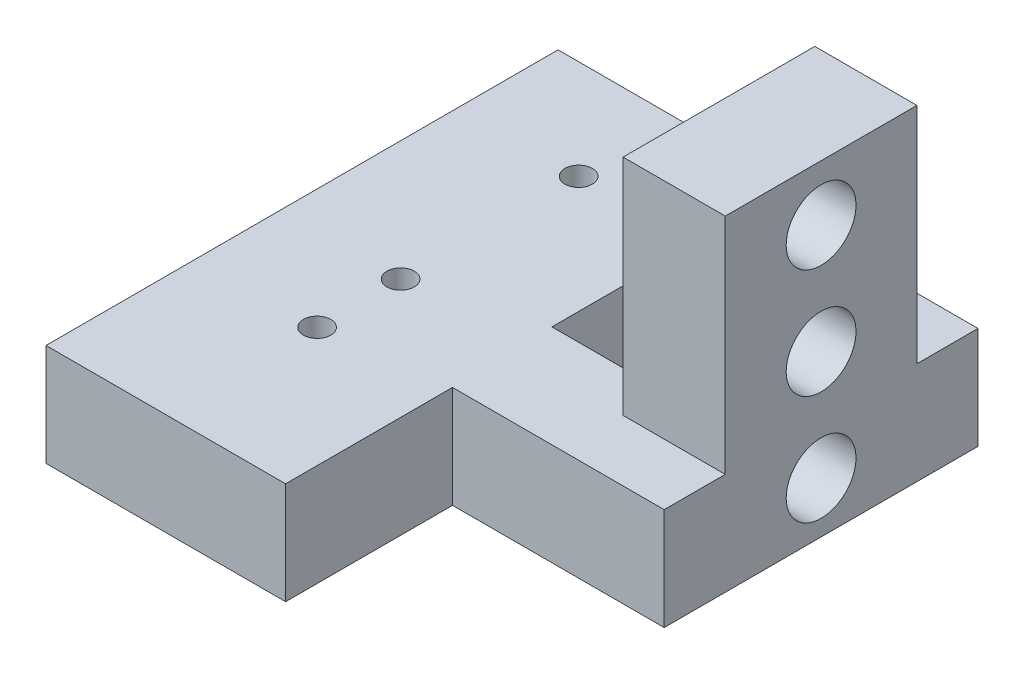
from build123d import *

# Parameters (mm, degrees)
SKETCH1_W           = 8.2
SKETCH1_H           = 8
BOSS_EXTRUDE1_DEPTH = 7.46
BOSS_EXTRUDE2_DEPTH = 16.34
SKETCH4_R           = 2.55
CUT_EXTRUDE1_DEPTH  = 43.142763317
CUT_EXTRUDE2_DEPTH  = 1.1
CUT_EXTRUDE4_REACH  = 42.752
SKETCH6_R           = 1


with BuildPart() as part:
    # Sketch1 → Boss-Extrude1 (new body)
    with BuildSketch(Plane(origin=(0, 0, 0), x_dir=(1, 0, 0), z_dir=(0, 1, 0))):
        Polygon((8.75, 11.46), (24.21, 11.46), (24.21, -11.46), (8.75, -11.46), (8.75, -23.65), (-8.75, -23.65), (-8.75, 13.75), (8.75, 13.75), align=None)
        with Locations((12.65, 0)):
            Rectangle(SKETCH1_W, SKETCH1_H, mode=Mode.SUBTRACT)
    extrude(amount=BOSS_EXTRUDE1_DEPTH)

    # Sketch3 → Boss-Extrude2 (add)
    with BuildSketch(Plane(origin=(0, 7.46, 0), x_dir=(1, 0, 0), z_dir=(0, 1, 0))):
        Polygon((16.75, 7), (24.21, 7), (24.21, -7), (16.75, -7), (16.75, -4), (16.75, 4), align=None)
    extrude(amount=BOSS_EXTRUDE2_DEPTH)

    # Sketch4 → Cut-Extrude1 (cut, through all)
    with BuildSketch(Plane.ZY.offset(-16.75)):
        with Locations((0, 3.73)):
            Circle(SKETCH4_R)
        with Locations((0, 11.73)):
            Circle(SKETCH4_R)
        with Locations((0, 19.73)):
            Circle(SKETCH4_R)
    extrude(amount=-CUT_EXTRUDE1_DEPTH, mode=Mode.SUBTRACT)

    # Sketch5 → Cut-Extrude2 (cut)
    with BuildSketch(Plane.XZ):
        with BuildLine():
            Line((-2.113983221, 14.966101695), (-3.606206671, 0.368644068))
            ThreePointArc((-3.606206671, 0.368644068), (-3.625, 0), (-3.606206671, -0.368644068))
            Line((-3.606206671, -0.368644068), (-2.113983221, -14.966101695))
            ThreePointArc((-2.113983221, -14.966101695), (0, -16.875), (2.113983221, -14.966101695))
            Line((2.113983221, -14.966101695), (3.606206671, -0.368644068))
            ThreePointArc((3.606206671, -0.368644068), (3.625, 0), (3.606206671, 0.368644068))
            Line((3.606206671, 0.368644068), (2.113983221, 14.966101695))
            ThreePointArc((2.113983221, 14.966101695), (0, 16.875), (-2.113983221, 14.966101695))
        make_face()
    extrude(amount=-CUT_EXTRUDE2_DEPTH, mode=Mode.SUBTRACT)

    # Sketch6 → Cut-Extrude4 (cut, up to next)
    with BuildSketch(Plane.XZ.offset(-1.1), mode=Mode.PRIVATE) as cut_extrude4_sk1:
        with Locations(Location((0, 12.6, 0), (0, 0, 270))):
            Circle(SKETCH6_R)
    cut_extrude4_tool1 = extrude(cut_extrude4_sk1.sketch, amount=-CUT_EXTRUDE4_REACH, mode=Mode.PRIVATE) & part.part
    # Sketch6 → Cut-Extrude4 (cut, up to next)
    with BuildSketch(Plane.XZ.offset(-1.1), mode=Mode.PRIVATE) as cut_extrude4_sk2:
        with Locations(Location((0, 6.5, 0), (0, 0, 270))):
            Circle(SKETCH6_R)
    cut_extrude4_tool2 = extrude(cut_extrude4_sk2.sketch, amount=-CUT_EXTRUDE4_REACH, mode=Mode.PRIVATE) & part.part
    # Sketch6 → Cut-Extrude4 (cut, up to next)
    with BuildSketch(Plane.XZ.offset(-1.1), mode=Mode.PRIVATE) as cut_extrude4_sk3:
        with Locations(Location((0, -6.5, 0), (0, 0, 270))):
            Circle(SKETCH6_R)
    cut_extrude4_tool3 = extrude(cut_extrude4_sk3.sketch, amount=-CUT_EXTRUDE4_REACH, mode=Mode.PRIVATE) & part.part
    add(cut_extrude4_tool1.solids().sort_by_distance((0, 1.1, 12.6))[0], mode=Mode.SUBTRACT)
    add(cut_extrude4_tool2.solids().sort_by_distance((0, 1.1, 6.5))[0], mode=Mode.SUBTRACT)
    add(cut_extrude4_tool3.solids().sort_by_distance((0, 1.1, -6.5))[0], mode=Mode.SUBTRACT)


solid = part.part
